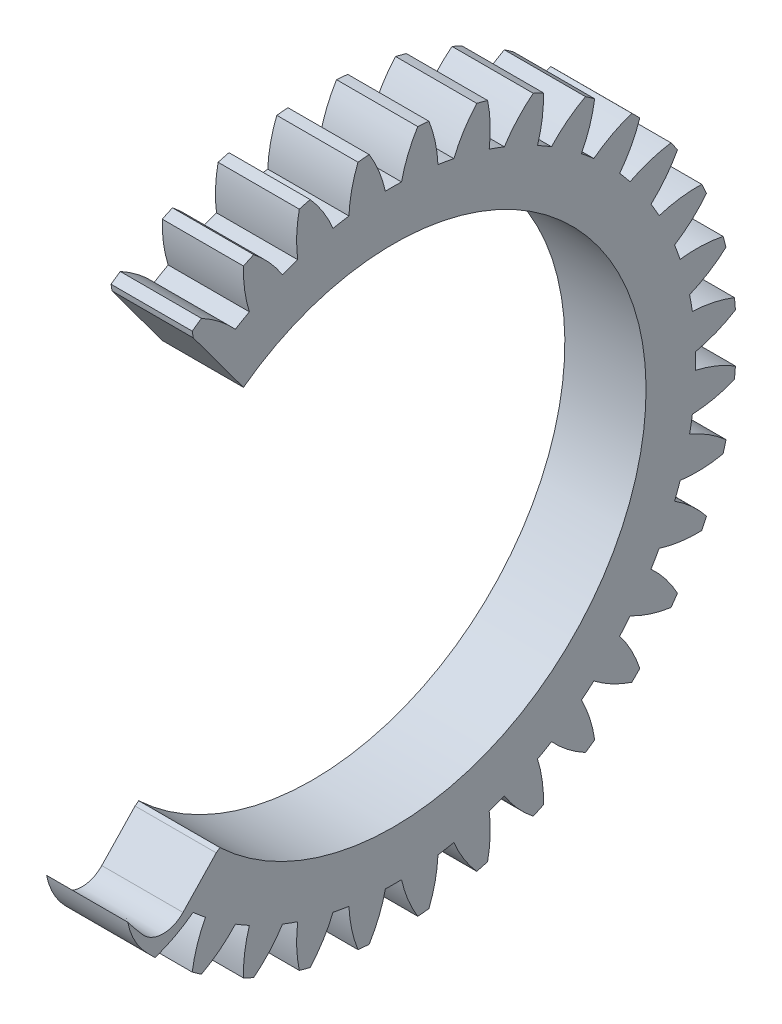
from build123d import *

# Parameters (mm, degrees)
BASPROSKE_W                     = 9
BASPROSKE_H                     = 38
TOOTHCUT_DEPTH                  = 55.488530903
TEETHCUTS_COUNT                 = 36
TEETHCUTS_ANGLE                 = 350
BORSKE_R                        = 28
BORE_DEPTH                      = 50.0000508
WYTNIJ_WYCI_GNI_CIE1_DEPTH      = 55.355469887
WYTNIJ_WYCI_GNI_CIE2_DEPTH      = 55.355469887
WYTNIJ_WYCI_GNI_CIE2_DEPTH_BACK = 43
DODANIE_WYCI_GNI_CIE1_DEPTH     = 9


with BuildPart() as part:
    # BasProSke → Base-Revolve (revolve)
    with BuildSketch(Plane(origin=(0, 0, 0), x_dir=(1, 0, 0), z_dir=(0, 1, 0)), mode=Mode.PRIVATE) as base_revolve_sk:
        with Locations((4.5, 19)):
            Rectangle(BASPROSKE_W, BASPROSKE_H)
    revolve(base_revolve_sk.sketch.rotate(Axis((-10, 0, 0), (1, 0, 0)), 180), axis=Axis((-10, 0, 0), (1, 0, 0)))

    # TooCutSke → ToothCut (cut, through all)
    with BuildSketch(Plane(origin=(0, 0, 0), x_dir=(0, 0, -1), z_dir=(1, 0, 0))):
        with BuildLine():
            ThreePointArc((0.894889921, 33.487044854), (0, 33.499), (-0.894889921, 33.487044854))
            ThreePointArc((-0.894889921, 33.487044854), (-1.614211666, 35.783966241), (-2.706066289, 37.928989578))
            ThreePointArc((-2.706066289, 37.928989578), (0, 38.0254), (2.706066289, 37.928989578))
            ThreePointArc((2.706066289, 37.928989578), (1.614211666, 35.783966241), (0.894889921, 33.487044854))
        make_face()
    toothcut = extrude(amount=TOOTHCUT_DEPTH, mode=Mode.SUBTRACT)

    # TeethCuts: ToothCut ×36 about axis
    teethcuts_axis = Axis((-10, 0, 0), (1, 0, 0))
    for i in range(1, TEETHCUTS_COUNT):
        add(toothcut.rotate(teethcuts_axis, i * TEETHCUTS_ANGLE / (TEETHCUTS_COUNT - 1)), mode=Mode.SUBTRACT)

    # BorSke → Bore (cut, symmetric)
    with BuildSketch(Plane(origin=(0, 0, 0), x_dir=(0, 0, -1), z_dir=(1, 0, 0))):
        with Locations(Location((0, 0, 0), (0, 0, 180))):
            Circle(BORSKE_R)
    extrude(amount=BORE_DEPTH, both=True, mode=Mode.SUBTRACT)

    # Szkic1 → Wytnij-wyciągnięcie1 (cut, through all)
    with BuildSketch(Plane(origin=(0, 0, 0), x_dir=(0, 0, -1), z_dir=(1, 0, 0))):
        Polygon((0, 0), (-27.328001911, 37.025896571), (-47.616429275, -10.23300831), align=None)
    extrude(amount=WYTNIJ_WYCI_GNI_CIE1_DEPTH, mode=Mode.SUBTRACT)

    # Szkic2 → Wytnij-wyciągnięcie2 (cut, two sides: drawn at the far end of the back side and taken through both)
    with BuildSketch(Plane(origin=(0, 0, 0), x_dir=(0, 0, -1), z_dir=(1, 0, 0)).offset(-WYTNIJ_WYCI_GNI_CIE2_DEPTH_BACK)):
        with BuildLine():
            ThreePointArc((-24.511766229, 27.715939752), (-36.928209226, 2.303771551), (-27.766430047, -24.45455709))
            Line((-27.766430047, -24.45455709), (-37.7355708, -29.369669028))
            Line((-37.7355708, -29.369669028), (-50.959375372, 25.255000318))
            Line((-50.959375372, 25.255000318), (-24.511766229, 27.715939752))
        make_face()
        with BuildLine():
            ThreePointArc((-24.511766229, 27.715939752), (-36.928209226, 2.303771551), (-27.766430047, -24.45455709))
            add(Edge.make_bspline(
                [(-27.766430047, -24.45455709), (-27.627676171, -24.612102359), (-27.474929263, -24.752340044), (-27.142564628, -24.999579662), (-26.960596433, -25.107419469), (-26.582905769, -25.280615776), (-26.386824535, -25.346934196), (-25.980084189, -25.43871427), (-25.771095301, -25.46325823), (-25.35717476, -25.468963499), (-25.148327304, -25.45030896), (-24.738384468, -25.370030277), (-24.540388957, -25.309415908), (-24.158025647, -25.14818839), (-23.972542629, -25.04633307), (-23.631161065, -24.810199406), (-23.473267418, -24.675407476), (-23.328599348, -24.523330498)],
                knots=[0, 0, 0, 0, 0.125, 0.125, 0.25, 0.25, 0.375, 0.375, 0.5, 0.5, 0.625, 0.625, 0.75, 0.75, 0.875, 0.875, 1, 1, 1, 1], degree=3))
            Line((-23.328599348, -24.523330498), (-19.64326816, -20.649261876))
            Line((-19.64326816, -20.649261876), (-14.218150146, -16.649337399))
            Line((-14.218150146, -16.649337399), (-24.511766229, 27.715939752))
        make_face()
    extrude(amount=WYTNIJ_WYCI_GNI_CIE2_DEPTH + WYTNIJ_WYCI_GNI_CIE2_DEPTH_BACK, mode=Mode.SUBTRACT)

    # Szkic2<3> → Dodanie-wyciągnięcie1 (add)
    with BuildSketch(Plane(origin=(0, 0, 0), x_dir=(0, 0, -1), z_dir=(1, 0, 0))):
        with BuildLine():
            Line((-28.533534607, -24.832764688), (-27.766430047, -24.45455709))
            ThreePointArc((-27.766430047, -24.45455709), (-28.625240796, -23.443455151), (-29.447253096, -22.402216076))
            ThreePointArc((-29.447253096, -22.402216076), (-29.092263149, -23.655786205), (-28.533534607, -24.832764688))
        make_face()
        with BuildLine():
            Line((-26.426026687, -27.306869347), (-25.067458385, -25.431781919))
            add(Edge.make_bspline(
                [(-27.766430047, -24.45455709), (-27.627676171, -24.612102359), (-27.474929263, -24.752340044), (-27.142564628, -24.999579662), (-26.960596433, -25.107419469), (-26.582905769, -25.280615776), (-26.386824535, -25.346934196), (-25.980084189, -25.43871427), (-25.771095301, -25.46325823), (-25.398801111, -25.468389743), (-25.232262808, -25.456942959), (-25.067458385, -25.431781919)],
                knots=[0, 0, 0, 0, 0.125, 0.125, 0.25, 0.25, 0.375, 0.375, 0.5, 0.5, 0.599858489, 0.599858489, 0.599858489, 0.599858489], degree=3))
            Line((-27.766430047, -24.45455709), (-28.533534607, -24.832764688))
            ThreePointArc((-28.533534607, -24.832764688), (-27.971766911, -25.669095946), (-27.306869347, -26.426026687))
            Line((-27.306869347, -26.426026687), (-26.426026687, -27.306869347))
        make_face()
    extrude(amount=DODANIE_WYCI_GNI_CIE1_DEPTH)


solid = part.part
